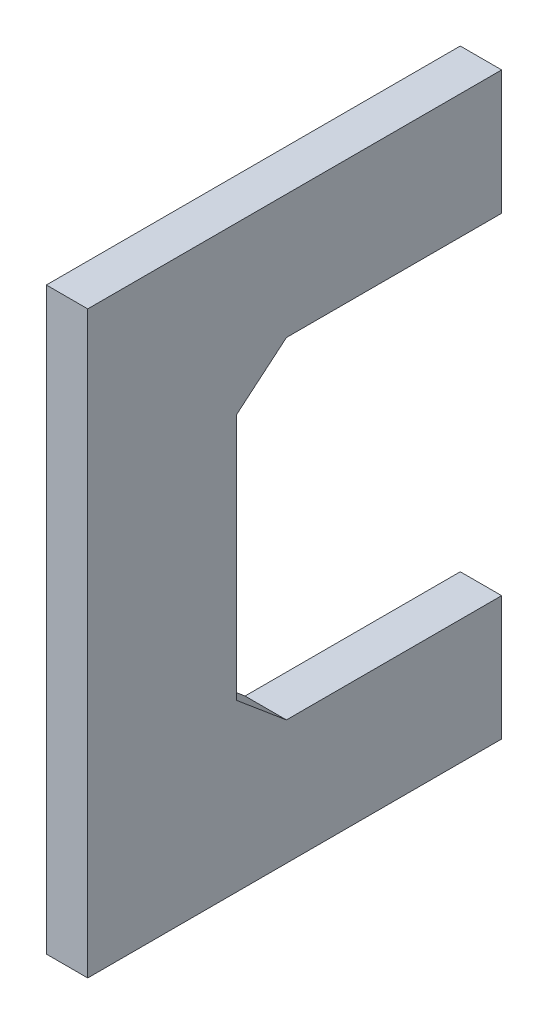
from build123d import *

# Parameters (mm, degrees)
SKIZZE1_W                       = 50
SKIZZE1_H                       = 70
AUFSATZ_LINEAR_AUSTRAGEN1_DEPTH = 5
SCHNITT_LINEAR_AUSTRAGEN1_DEPTH = 87.168439698


with BuildPart() as part:
    # Skizze1 → Aufsatz-Linear austragen1 (new body)
    with BuildSketch(Plane(origin=(0, 0, 0), x_dir=(0, 0, -1), z_dir=(1, 0, 0))):
        with Locations((25, 35)):
            Rectangle(SKIZZE1_W, SKIZZE1_H)
    extrude(amount=AUFSATZ_LINEAR_AUSTRAGEN1_DEPTH)

    # Skizze2 → Schnitt-Linear austragen1 (cut, through all)
    with BuildSketch(Plane(origin=(5, 0, 0), x_dir=(0, 0, -1), z_dir=(1, 0, 0))):
        Polygon((18, 20.034597787), (18, 49.965402213), (24, 55), (50, 55), (50, 15), (24, 15), align=None)
    extrude(amount=-SCHNITT_LINEAR_AUSTRAGEN1_DEPTH, mode=Mode.SUBTRACT)


solid = part.part
